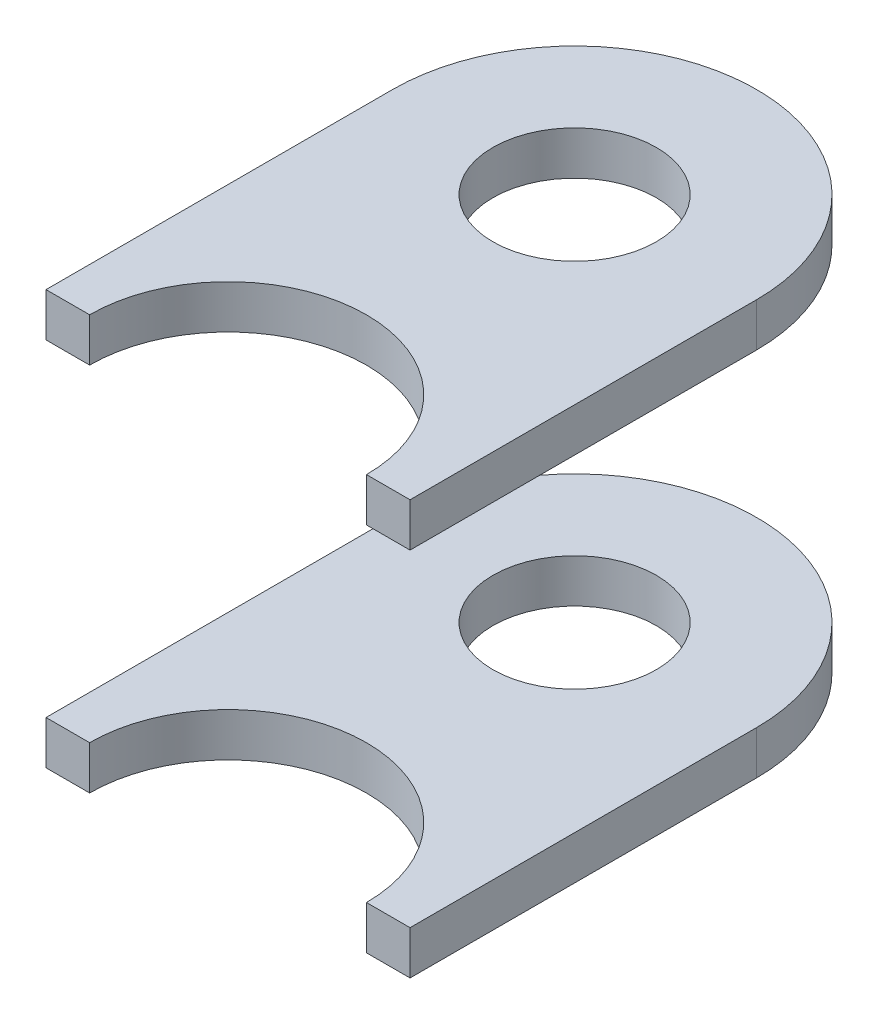
from build123d import *

# Parameters (mm, degrees)
SKETCH1_R           = 7.5
BOSS_EXTRUDE1_DEPTH = 4


with BuildPart() as part:
    # Sketch1 → Boss-Extrude1 (new body)
    with BuildSketch(Plane(origin=(0, 15, 0), x_dir=(1, 0, 0), z_dir=(0, 1, 0))):
        with BuildLine():
            Line((16.7, -31.8), (12.7, -31.8))
            ThreePointArc((12.7, -31.8), (0, -19.1), (-12.7, -31.8))
            Line((-12.7, -31.8), (-16.7, -31.8))
            Line((-16.7, -31.8), (-16.7, 0))
            ThreePointArc((-16.7, 0), (0, 16.7), (16.7, 0))
            Line((16.7, 0), (16.7, -31.8))
        make_face()
        Circle(SKETCH1_R, mode=Mode.SUBTRACT)
    extrude(amount=BOSS_EXTRUDE1_DEPTH)


with BuildPart() as body_2:
    # Mirror1: mirrored copy
    add(part.part.mirror(Plane.ZX))


solid = Compound([part.part, body_2.part])
